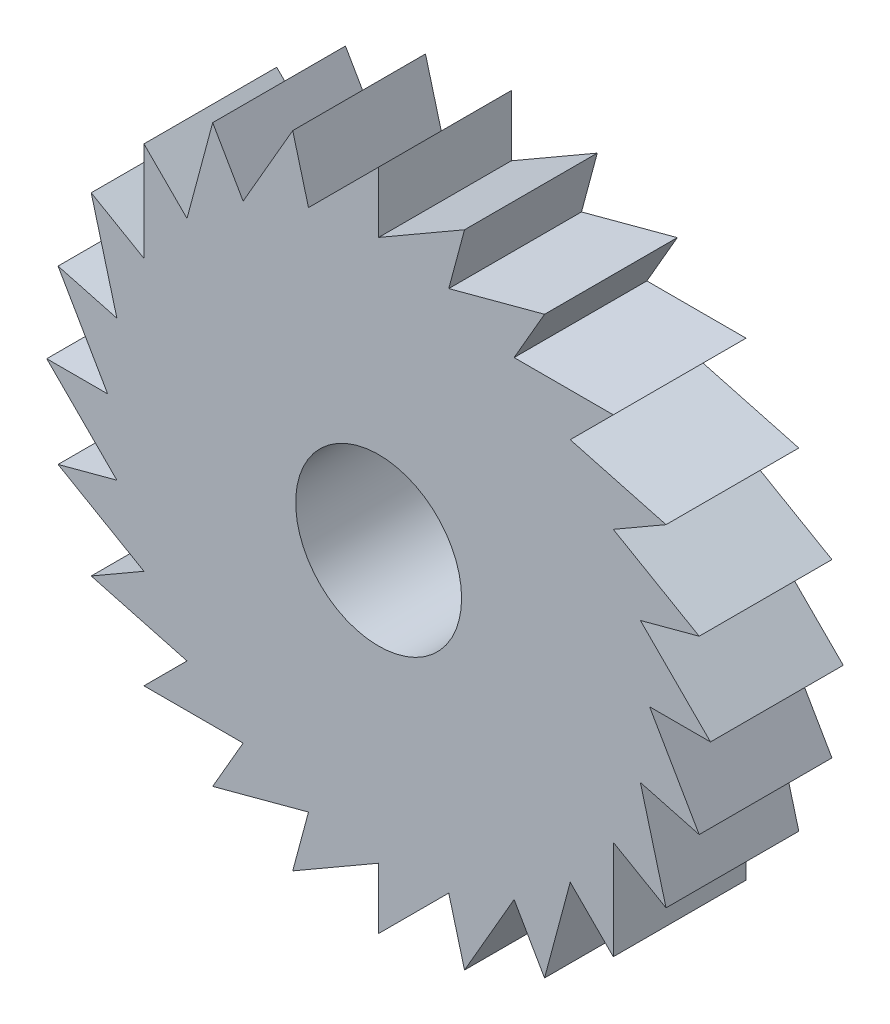
from build123d import *

# Parameters (mm, degrees)
SKETCH1_R           = 3.175
BOSS_EXTRUDE1_DEPTH = 5.08


with BuildPart() as part:
    # Sketch1 → Boss-Extrude1 (new body)
    with BuildSketch(Plane.XY):
        Polygon((-2.683825791, 10.016174209), (0, 12.7), (0, 10.369506578), (3.287001873, 12.267257994), (2.683825791, 10.016174209), (6.35, 10.998522628), (5.184753289, 8.980256121), (8.980256121, 8.980256121), (7.332348419, 7.332348419), (10.998522628, 6.35), (8.980256121, 5.184753289), (12.267257994, 3.287001873), (10.016174209, 2.683825791), (12.7, 0), (10.369506578, 0), (12.267257994, -3.287001873), (10.016174209, -2.683825791), (10.998522628, -6.35), (8.980256121, -5.184753289), (8.980256121, -8.980256121), (7.332348419, -7.332348419), (6.35, -10.998522628), (5.184753289, -8.980256121), (3.287001873, -12.267257994), (2.683825791, -10.016174209), (0, -12.7), (0, -10.369506578), (-3.287001873, -12.267257994), (-2.683825791, -10.016174209), (-6.35, -10.998522628), (-5.184753289, -8.980256121), (-8.980256121, -8.980256121), (-7.332348419, -7.332348419), (-10.998522628, -6.35), (-8.980256121, -5.184753289), (-12.267257994, -3.287001873), (-10.016174209, -2.683825791), (-12.7, 0), (-10.369506578, 0), (-12.267257994, 3.287001873), (-10.016174209, 2.683825791), (-10.998522628, 6.35), (-8.980256121, 5.184753289), (-8.980256121, 8.980256121), (-7.332348419, 7.332348419), (-6.35, 10.998522628), (-5.184753289, 8.980256121), (-3.287001873, 12.267257994), align=None)
        Circle(SKETCH1_R, mode=Mode.SUBTRACT)
    extrude(amount=BOSS_EXTRUDE1_DEPTH)


solid = part.part
